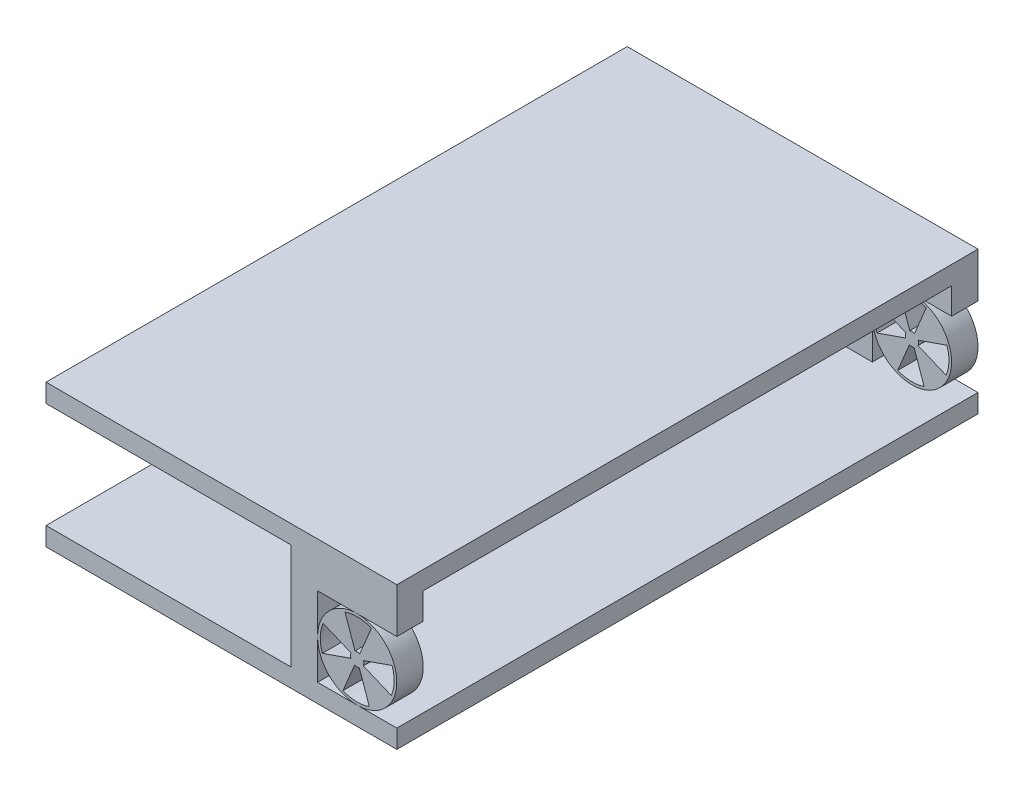
from build123d import *

# Parameters (mm, degrees)
SKETCH2_W           = 347.98
SKETCH2_H           = 558.8
BOSS_EXTRUDE1_DEPTH = 17.78
SKETCH3_W           = 25.4
SKETCH3_H           = 25.4
BOSS_EXTRUDE2_DEPTH = 101.6
SKETCH4_W           = 25.4
SKETCH4_H           = 25.4
BOSS_EXTRUDE3_DEPTH = 76.2
BOSS_EXTRUDE4_START = 279.4
SKETCH5_R           = 38.1
BOSS_EXTRUDE4_DEPTH = 25.4
BOSS_EXTRUDE5_START = -279.4
SKETCH5_2_R         = 38.1
BOSS_EXTRUDE5_DEPTH = 25.4
CUT_EXTRUDE2_DEPTH  = 1270
BOSS_EXTRUDE6_START = 119.38
SKETCH2_2_W         = 347.98
SKETCH2_2_H         = 558.8
BOSS_EXTRUDE6_DEPTH = 17.78
SKETCH7_W           = 10.668
SKETCH7_H           = 558.8
CUT_EXTRUDE3_DEPTH  = 381


with BuildPart() as part:
    # Sketch2 → Boss-Extrude1 (new body)
    with BuildSketch(Plane(origin=(0, 0, 0), x_dir=(1, 0, 0), z_dir=(0, 1, 0))):
        Rectangle(SKETCH2_W, SKETCH2_H)
    extrude(amount=BOSS_EXTRUDE1_DEPTH)

    # Sketch3 → Boss-Extrude2 (add)
    with BuildSketch(Plane(origin=(0, 17.78, 0), x_dir=(1, 0, 0), z_dir=(0, 1, 0))):
        with Locations((85.09, -266.7)):
            Rectangle(SKETCH3_W, SKETCH3_H)
        with Locations((85.09, 266.7)):
            Rectangle(SKETCH3_W, SKETCH3_H)
    extrude(amount=BOSS_EXTRUDE2_DEPTH)

    # Sketch4 → Boss-Extrude3 (add)
    with BuildSketch(Plane(origin=(97.79, 0, 0), x_dir=(0, 0, -1), z_dir=(1, 0, 0))):
        with Locations((-266.7, 106.68)):
            Rectangle(SKETCH4_W, SKETCH4_H)
        with Locations((266.7, 106.68)):
            Rectangle(SKETCH4_W, SKETCH4_H)
    extrude(amount=BOSS_EXTRUDE3_DEPTH)

    # Sketch2<2> → Boss-Extrude6 (add)
    with BuildSketch(Plane(origin=(0, 0, 0), x_dir=(1, 0, 0), z_dir=(0, 1, 0)).offset(BOSS_EXTRUDE6_START)):
        Rectangle(SKETCH2_2_W, SKETCH2_2_H)
    extrude(amount=BOSS_EXTRUDE6_DEPTH)

    # Sketch7 → Cut-Extrude3 (cut)
    with BuildSketch(Plane(origin=(0, 0, 0), x_dir=(1, 0, 0), z_dir=(0, 1, 0))):
        with Locations((-168.656, 0)):
            Rectangle(SKETCH7_W, SKETCH7_H)
    extrude(amount=CUT_EXTRUDE3_DEPTH, mode=Mode.SUBTRACT)


with BuildPart() as body_2:
    # Sketch5 → Boss-Extrude4 (new body)
    with BuildSketch(Plane.XY.offset(BOSS_EXTRUDE4_START)):
        with Locations(Location((135.89, 55.88, 0), (0, 0, 180))):
            Circle(SKETCH5_R)
    extrude(amount=-BOSS_EXTRUDE4_DEPTH)


with BuildPart() as body_3:
    # Sketch5<2> → Boss-Extrude5 (new body)
    with BuildSketch(Plane.XY.offset(BOSS_EXTRUDE5_START)):
        with Locations((135.89, 55.88)):
            Circle(SKETCH5_2_R)
    extrude(amount=BOSS_EXTRUDE5_DEPTH)


with BuildPart() as cut_extrude2_tool:
    # Sketch6 → Cut-Extrude2 (new body)
    with BuildSketch(Plane.XY.offset(279.4)):
        with BuildLine():
            Line((124.184641238, 89.458239624), (133.799757364, 61.876114219))
            ThreePointArc((133.799757364, 61.876114219), (136.079078703, 62.227184356), (138.333460475, 61.741058002))
            Line((138.333460475, 61.741058002), (149.57337866, 88.701924813))
            ThreePointArc((149.57337866, 88.701924813), (136.948840735, 91.424232391), (124.184641238, 89.458239624))
        make_face()
        with BuildLine():
            Line((169.468239624, 67.585358762), (141.886114219, 57.970242636))
            ThreePointArc((141.886114219, 57.970242636), (142.237184356, 55.690921297), (141.751058002, 53.436539525))
            Line((141.751058002, 53.436539525), (168.711924813, 42.19662134))
            ThreePointArc((168.711924813, 42.19662134), (171.434232391, 54.821159265), (169.468239624, 67.585358762))
        make_face()
        with BuildLine():
            Line((147.595358762, 22.301760376), (137.980242636, 49.883885781))
            ThreePointArc((137.980242636, 49.883885781), (135.700921297, 49.532815644), (133.446539525, 50.018941998))
            Line((133.446539525, 50.018941998), (122.20662134, 23.058075187))
            ThreePointArc((122.20662134, 23.058075187), (134.831159265, 20.335767609), (147.595358762, 22.301760376))
        make_face()
        with BuildLine():
            Line((102.311760376, 44.174641238), (129.893885781, 53.789757364))
            ThreePointArc((129.893885781, 53.789757364), (129.542815644, 56.069078703), (130.028941998, 58.323460475))
            Line((130.028941998, 58.323460475), (103.068075187, 69.56337866))
            ThreePointArc((103.068075187, 69.56337866), (100.345767609, 56.938840735), (102.311760376, 44.174641238))
        make_face()
    extrude(amount=-CUT_EXTRUDE2_DEPTH)


with BuildPart() as body_2_1:
    add(body_2.part)

    # Cut-Extrude2: cut by cut_extrude2_tool
    add(cut_extrude2_tool.part, mode=Mode.SUBTRACT)


with BuildPart() as body_3_1:
    add(body_3.part)

    # Cut-Extrude2: cut by cut_extrude2_tool
    add(cut_extrude2_tool.part, mode=Mode.SUBTRACT)


solid = Compound([part.part, body_2_1.part, body_3_1.part])
